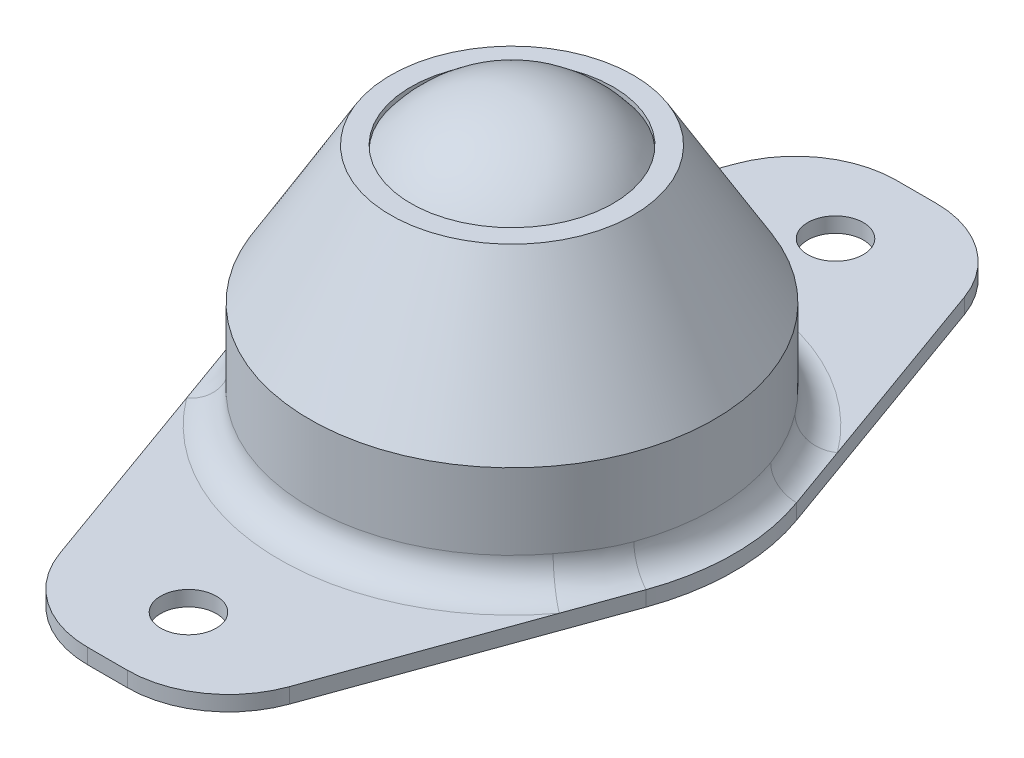
from build123d import *

# Parameters (mm, degrees)
BOSS_EXTRUDE1_START = 1.5
SKETCH2_R           = 2.75
SKETCH2_R_2         = 20
BOSS_EXTRUDE1_DEPTH = 1.5
FILLET1_R           = 3


with BuildPart() as part:
    # Sketch1 → Revolve1 (revolve)
    with BuildSketch(Plane.XY, mode=Mode.PRIVATE) as revolve1_sk:
        with BuildLine():
            ThreePointArc((0, 30), (-12.5, 17.5), (0, 5))
            Line((0, 5), (0, 30))
        make_face()
        with BuildLine():
            Line((0, 30), (0, 5))
            ThreePointArc((0, 5), (8.838834765, 8.661165235), (12.5, 17.5))
            ThreePointArc((12.5, 17.5), (11.858541226, 21.452847075), (10, 25))
            ThreePointArc((10, 25), (5.590169944, 28.680339887), (0, 30))
        make_face()
        with BuildLine():
            Line((0, 5), (0, 0))
            Line((0, 0), (20, 0))
            Line((20, 0), (20, 12))
            Line((20, 12), (12, 25.5))
            Line((12, 25.5), (10, 25.5))
            Line((10, 25.5), (10, 25))
            ThreePointArc((10, 25), (11.858541226, 21.452847075), (12.5, 17.5))
            ThreePointArc((12.5, 17.5), (8.838834765, 8.661165235), (0, 5))
        make_face()
    revolve(revolve1_sk.sketch.rotate(Axis((0, 0, 0), (0, 1, 0)), 90), axis=Axis((0, 0, 0), (0, 1, 0)))

    # Sketch2 → Boss-Extrude1 (add)
    with BuildSketch(Plane(origin=(0, 0, 0), x_dir=(1, 0, 0), z_dir=(0, 1, 0)).offset(BOSS_EXTRUDE1_START)):
        with BuildLine():
            Line((-11.378629516, 33.382634205), (-20.703132213, 7.441795252))
            ThreePointArc((-20.703132213, 7.441795252), (0, -22), (20.703132213, 7.441795252))
            Line((20.703132213, 7.441795252), (11.378629516, 33.382634205))
            ThreePointArc((11.378629516, 33.382634205), (7.720230047, 38.180047129), (1.968114874, 40))
            Line((1.968114874, 40), (-1.968114874, 40))
            ThreePointArc((-1.968114874, 40), (-7.720230047, 38.180047129), (-11.378629516, 33.382634205))
        make_face()
        with Locations(Location((0, 32, 0), (0, 0, 270))):
            Circle(SKETCH2_R, mode=Mode.SUBTRACT)
        with Locations(Location((0, 0, 0), (0, 0, 90))):
            Circle(SKETCH2_R_2, mode=Mode.SUBTRACT)
    boss_extrude1 = extrude(amount=-BOSS_EXTRUDE1_DEPTH)

    # Mirror1: Boss-Extrude1 across plane
    add(boss_extrude1.mirror(Plane.XY))

    # Fillet1
    fillet1_edges = [part.edges().sort_by_distance(p)[0] for p in [
        (0, 1.5, 20),
    ]]
    fillet(fillet1_edges, radius=FILLET1_R)


solid = part.part
